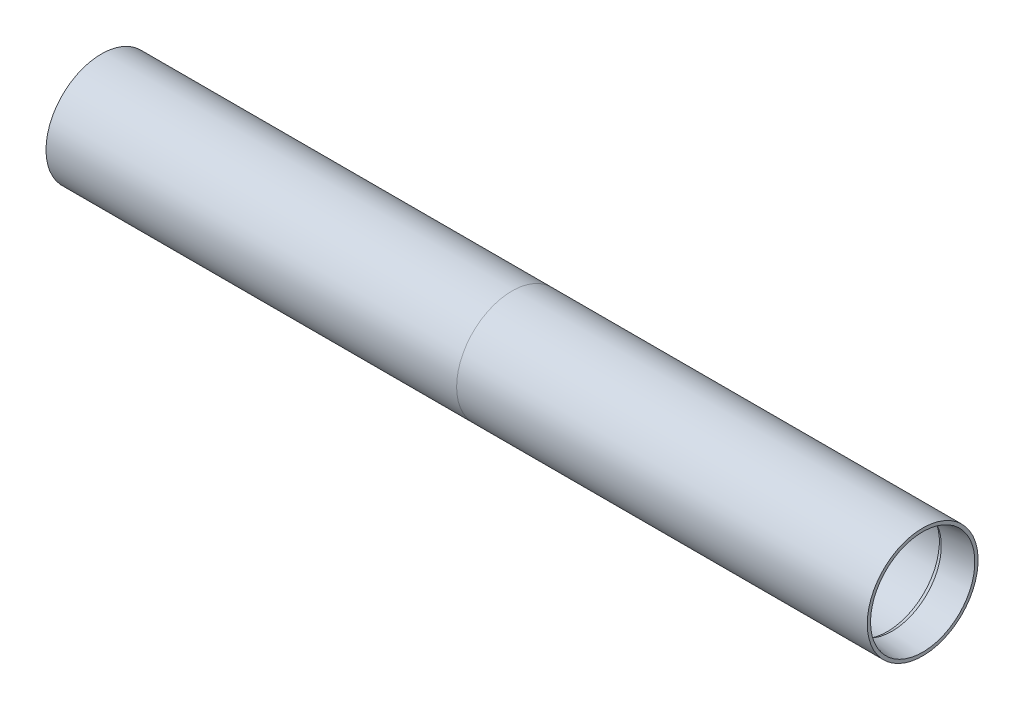
from build123d import *


with BuildPart() as part:
    # Sketch1 → Revolve1 (revolve)
    with BuildSketch(Plane(origin=(0, 0, 0), x_dir=(1, 0, 0), z_dir=(0, 1, 0)), mode=Mode.PRIVATE) as revolve1_sk:
        Polygon((185, 24.087670047), (182.726977845, 25.4), (0, 25.4), (0, 27), (200, 27), (200, 25.4), align=None)
    revolve(revolve1_sk.sketch.rotate(Axis((0, 0, 0), (1, 0, 0)), 180), axis=Axis((0, 0, 0), (1, 0, 0)))


with BuildPart() as body_2:
    # Sketch2 → Revolve2 (revolve)
    with BuildSketch(Plane(origin=(0, 0, 0), x_dir=(1, 0, 0), z_dir=(0, 1, 0)), mode=Mode.PRIVATE) as revolve2_sk:
        Polygon((382.726977845, 25.4), (217.273022155, 25.4), (215, 24.087670047), (200, 25.4), (200, 27), (400, 27), (400, 25.4), (385, 24.087670047), align=None)
    revolve(revolve2_sk.sketch.rotate(Axis((0, 0, 0), (1, 0, 0)), 180), axis=Axis((0, 0, 0), (1, 0, 0)))


with BuildPart() as body_3:
    # Sketch4 → Revolve3 (revolve)
    with BuildSketch(Plane(origin=(0, 0, 0), x_dir=(1, 0, 0), z_dir=(0, 1, 0)), mode=Mode.PRIVATE) as revolve3_sk:
        Polygon((200, 25.299618016), (185.008715574, 23.988050577), (185.008715574, 22.988050577), (214.991284426, 22.988050577), (214.991284426, 23.988050577), align=None)
    revolve(revolve3_sk.sketch.rotate(Axis((0, 0, 0), (1, 0, 0)), 180), axis=Axis((0, 0, 0), (1, 0, 0)))


solid = Compound([part.part, body_2.part, body_3.part])
